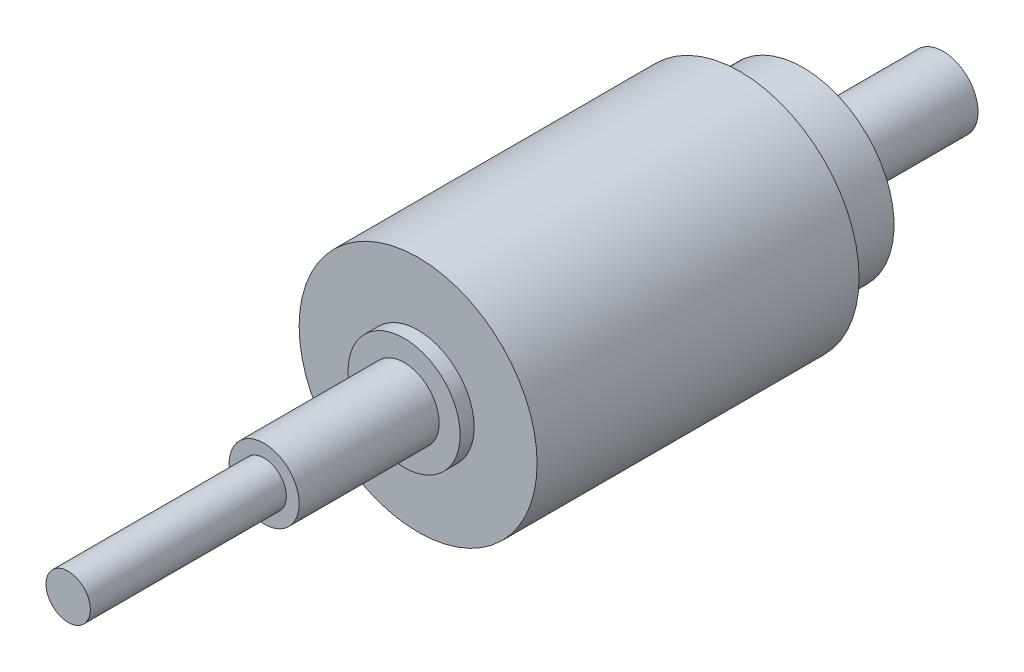
from build123d import *

# Parameters (mm, degrees)
SKETCH1_R           = 8.5
BOSS_EXTRUDE1_DEPTH = 23
SKETCH2_R           = 4
BOSS_EXTRUDE2_DEPTH = 1
SKETCH3_R           = 2.5
BOSS_EXTRUDE3_DEPTH = 10
SKETCH4_R           = 6.5
BOSS_EXTRUDE4_DEPTH = 4.5
BOSS_EXTRUDE5_START = 10
SKETCH5_R           = 2.5
BOSS_EXTRUDE5_DEPTH = 10
SKETCH7_R           = 1.585
BOSS_EXTRUDE6_DEPTH = 14


with BuildPart() as part:
    # Sketch1 → Boss-Extrude1 (new body)
    with BuildSketch(Plane.XY):
        Circle(SKETCH1_R)
    extrude(amount=BOSS_EXTRUDE1_DEPTH)

    # Sketch2 → Boss-Extrude2 (add)
    with BuildSketch(Plane.XY.offset(23)):
        Circle(SKETCH2_R)
    extrude(amount=BOSS_EXTRUDE2_DEPTH)

    # Sketch3 → Boss-Extrude3 (add)
    with BuildSketch(Plane.XY.offset(24)):
        Circle(SKETCH3_R)
    extrude(amount=BOSS_EXTRUDE3_DEPTH)

    # Sketch4 → Boss-Extrude4 (add)
    with BuildSketch(Plane(origin=(0, 0, 0), x_dir=(-1, 0, 0), z_dir=(0, 0, -1))):
        Circle(SKETCH4_R)
    extrude(amount=BOSS_EXTRUDE4_DEPTH)

    # Sketch5 → Boss-Extrude5 (add)
    with BuildSketch(Plane(origin=(0, 0, -4.5), x_dir=(-1, 0, 0), z_dir=(0, 0, -1)).offset(BOSS_EXTRUDE5_START)):
        with Locations(Location((0, 0, 0), (0, 0, 180))):
            Circle(SKETCH5_R)
    extrude(amount=-BOSS_EXTRUDE5_DEPTH)

    # Sketch7 → Boss-Extrude6 (add)
    with BuildSketch(Plane.XY.offset(34)):
        Circle(SKETCH7_R)
    extrude(amount=BOSS_EXTRUDE6_DEPTH)


solid = part.part
